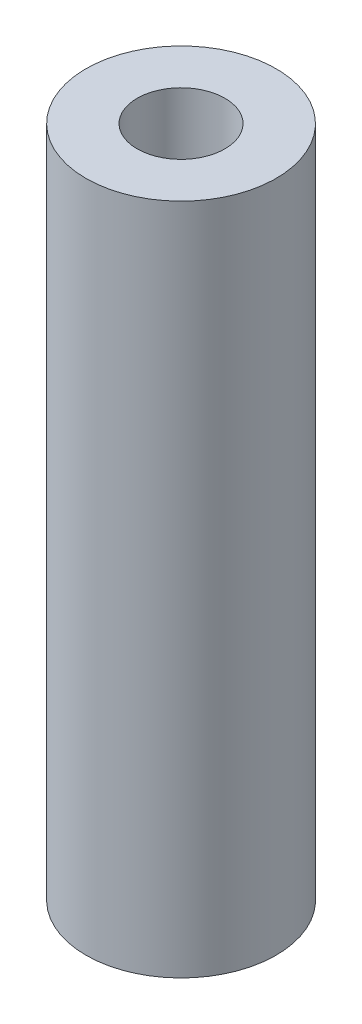
from build123d import *

# Parameters (mm, degrees)
ESQUISSE2_R             = 3.25
BOSS_EXTRU_1_DEPTH      = 23
ESQUISSE1_R             = 1.5
ENL_V_MAT_EXTRU_1_DEPTH = 28


with BuildPart() as part:
    # Esquisse2 → Boss.-Extru.1 (new body)
    with BuildSketch(Plane(origin=(0, 0, 0), x_dir=(1, 0, 0), z_dir=(0, 1, 0))):
        with Locations(Location((0, 0, 0), (0, 0, 270))):
            Circle(ESQUISSE2_R)
    extrude(amount=BOSS_EXTRU_1_DEPTH)

    # Esquisse1 → Enlèv. mat.-Extru.1 (cut)
    with BuildSketch(Plane(origin=(0, 0, 0), x_dir=(1, 0, 0), z_dir=(0, 1, 0))):
        with Locations(Location((0, 0, 0), (0, 0, 270))):
            Circle(ESQUISSE1_R)
    extrude(amount=ENL_V_MAT_EXTRU_1_DEPTH, mode=Mode.SUBTRACT)


solid = part.part
